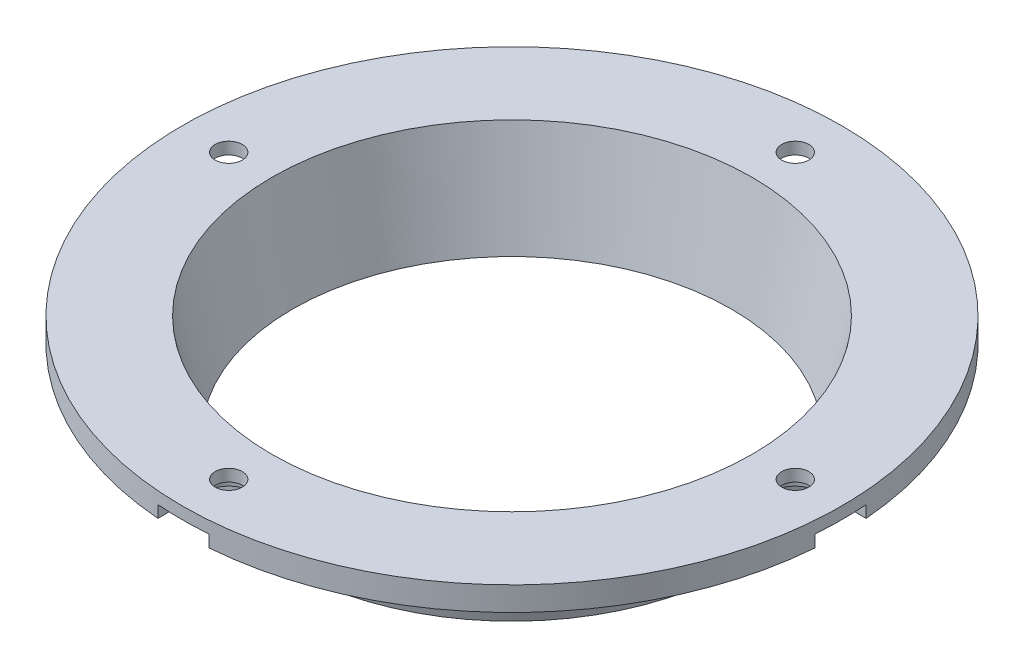
from build123d import *

# Parameters (mm, degrees)
SKETCH3_R          = 1.7
CUT_EXTRUDE1_DEPTH = 1.5
SKETCH3_3_R        = 1.7
CUT_EXTRUDE2_DEPTH = 62.692059893


with BuildPart() as part:
    # Sketch2 → Revolve1 (revolve)
    with BuildSketch(Plane.XY):
        Polygon((-37.876178005, 30.628606655), (-37.876178005, 27.628606655), (-27.076178005, 27.628606655), (-25.076178005, 17.628606655), (-24.056390036, 17.628606655), (-26.656390036, 30.628606655), align=None)
    revolve(axis=Axis((3.423821995, 17.628606655, 0), (0, 1, 0)))

    # Sketch3 → Cut-Extrude1 (cut)
    # profile 1 of 4: a face of its own
    with BuildSketch(Plane.XZ.offset(-27.628606655)):
        with BuildLine():
            Line((38.923821995, -3.2), (44.599664427, -3.2))
            ThreePointArc((44.599664427, -3.2), (44.723821995, 0), (44.599664427, 3.2))
            Line((44.599664427, 3.2), (38.923821995, 3.2))
            ThreePointArc((38.923821995, 3.2), (35.723821995, 0), (38.923821995, -3.2))
        make_face()
        with Locations((38.923821995, 0)):
            Circle(SKETCH3_R, mode=Mode.SUBTRACT)
    # profile 2 of 4: a face of its own
    with BuildSketch(Plane.XZ.offset(-27.628606655)):
        with BuildLine():
            ThreePointArc((0.223821995, -41.175842432), (3.423821995, -41.3), (6.623821995, -41.175842432))
            Line((6.623821995, -41.175842432), (6.623821995, -35.5))
            ThreePointArc((6.623821995, -35.5), (3.423821995, -32.3), (0.223821995, -35.5))
            Line((0.223821995, -35.5), (0.223821995, -41.175842432))
        make_face()
        with Locations((3.423821995, -35.5)):
            Circle(SKETCH3_R, mode=Mode.SUBTRACT)
    # profile 3 of 4: a face of its own
    with BuildSketch(Plane.XZ.offset(-27.628606655)):
        with BuildLine():
            ThreePointArc((-37.752020437, 3.2), (-37.876178005, 0), (-37.752020437, -3.2))
            Line((-37.752020437, -3.2), (-32.076178005, -3.2))
            ThreePointArc((-32.076178005, -3.2), (-28.876178005, 0), (-32.076178005, 3.2))
            Line((-32.076178005, 3.2), (-37.752020437, 3.2))
        make_face()
        with Locations((-32.076178005, 0)):
            Circle(SKETCH3_R, mode=Mode.SUBTRACT)
    # profile 4 of 4: a face of its own
    with BuildSketch(Plane.XZ.offset(-27.628606655)):
        with BuildLine():
            Line((6.623821995, 35.5), (6.623821995, 41.175842432))
            ThreePointArc((6.623821995, 41.175842432), (3.423821995, 41.3), (0.223821995, 41.175842432))
            Line((0.223821995, 41.175842432), (0.223821995, 35.5))
            ThreePointArc((0.223821995, 35.5), (3.423821995, 32.3), (6.623821995, 35.5))
        make_face()
        with Locations((3.423821995, 35.5)):
            Circle(SKETCH3_R, mode=Mode.SUBTRACT)
    extrude(amount=-CUT_EXTRUDE1_DEPTH, mode=Mode.SUBTRACT)

    # Sketch3<3> → Cut-Extrude2 (cut, through all)
    with BuildSketch(Plane.XZ.offset(-27.628606655)):
        with Locations((3.423821995, 35.5)):
            Circle(SKETCH3_3_R)
        with Locations((-32.076178005, 0)):
            Circle(SKETCH3_3_R)
        with Locations((3.423821995, -35.5)):
            Circle(SKETCH3_3_R)
        with Locations((38.923821995, 0)):
            Circle(SKETCH3_3_R)
    extrude(amount=-CUT_EXTRUDE2_DEPTH, mode=Mode.SUBTRACT)


solid = part.part
